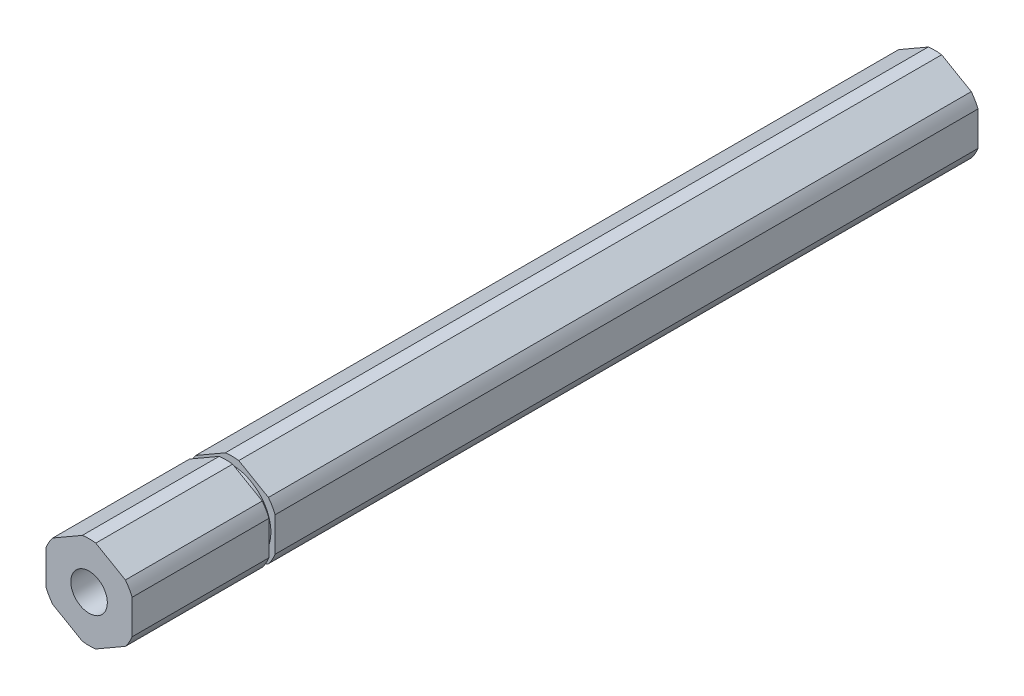
from build123d import *

# Parameters (mm, degrees)
BOSS_EXTRUDE1_DEPTH = 46.76775
SKETCH2_R           = 2.0193
CUT_EXTRUDE1_DEPTH  = 19.05
SKETCH4_R           = 6.35
SKETCH4_R_2         = 4.2926
CUT_EXTRUDE2_DEPTH  = 0.6858


with BuildPart() as part:
    # Sketch1 → Boss-Extrude1 (new, symmetric)
    with BuildSketch(Plane.XY):
        with BuildLine():
            ThreePointArc((4.7625, 1.891713919), (4.43790388, 2.562225), (4.019522311, 3.178589026))
            Line((4.019522311, 3.178589026), (0.742977689, 5.070302945))
            ThreePointArc((0.742977689, 5.070302945), (0, 5.12445), (-0.742977689, 5.070302945))
            Line((-0.742977689, 5.070302945), (-4.019522311, 3.178589026))
            ThreePointArc((-4.019522311, 3.178589026), (-4.43790388, 2.562225), (-4.7625, 1.891713919))
            Line((-4.7625, 1.891713919), (-4.7625, -1.891713919))
            ThreePointArc((-4.7625, -1.891713919), (-4.43790388, -2.562225), (-4.019522311, -3.178589026))
            Line((-4.019522311, -3.178589026), (-0.742977689, -5.070302945))
            ThreePointArc((-0.742977689, -5.070302945), (0, -5.12445), (0.742977689, -5.070302945))
            Line((0.742977689, -5.070302945), (4.019522311, -3.178589026))
            ThreePointArc((4.019522311, -3.178589026), (4.43790388, -2.562225), (4.7625, -1.891713919))
            Line((4.7625, -1.891713919), (4.7625, 1.891713919))
        make_face()
    extrude(amount=BOSS_EXTRUDE1_DEPTH, both=True)

    # Sketch2 → Cut-Extrude1 (cut)
    with BuildSketch(Plane(origin=(0, 0, -46.76775), x_dir=(-1, 0, 0), z_dir=(0, 0, -1))):
        Circle(SKETCH2_R)
    cut_extrude1 = extrude(amount=-CUT_EXTRUDE1_DEPTH, mode=Mode.SUBTRACT)

    # Mirror1: Cut-Extrude1 across plane
    add(cut_extrude1.mirror(Plane.XY), mode=Mode.SUBTRACT)

    # Sketch4 → Cut-Extrude2 (cut)
    with BuildSketch(Plane(origin=(0, 0, 30.95625), x_dir=(-1, 0, 0), z_dir=(0, 0, -1))):
        Circle(SKETCH4_R)
        Circle(SKETCH4_R_2, mode=Mode.SUBTRACT)
    extrude(amount=-CUT_EXTRUDE2_DEPTH, mode=Mode.SUBTRACT)


solid = part.part
